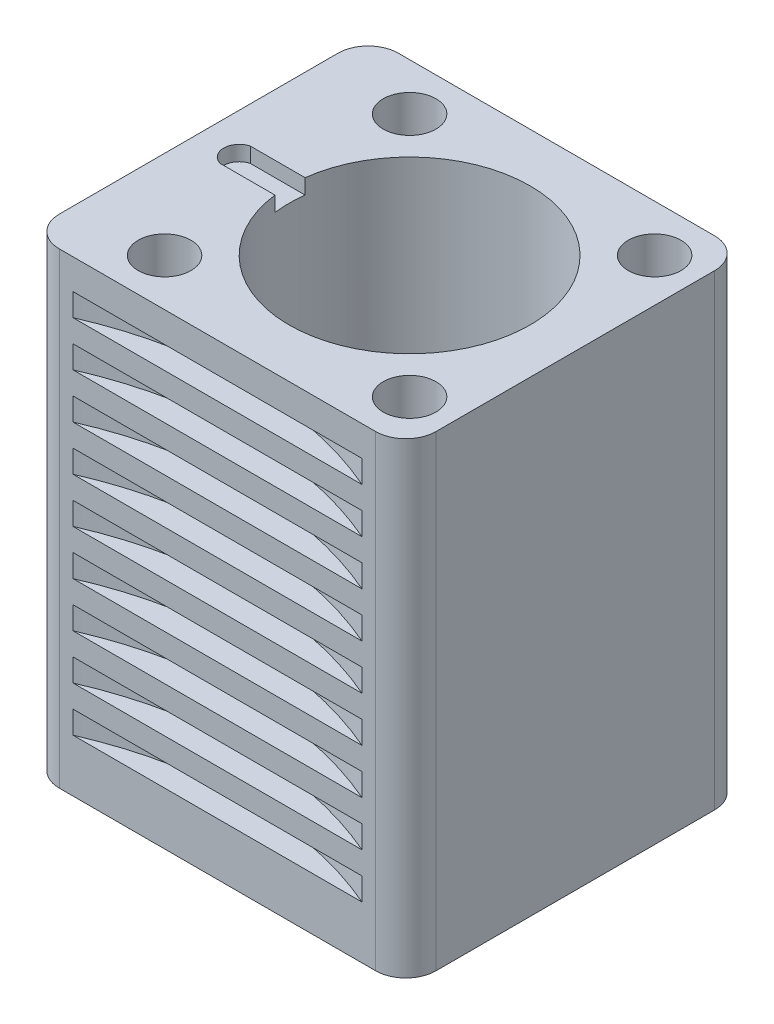
from build123d import *

# Parameters (mm, degrees)
BOSS_EXTRUDE1_DEPTH     = 62
SKETCH2_R               = 18
BOSS_EXTRUDE2_DEPTH     = 2
SKETCH3_R               = 16
CUT_EXTRUDE1_DEPTH      = 74.391075752
CUT_EXTRUDE2_DEPTH      = 2
SKETCH5_R               = 3.5
CUT_EXTRUDE3_DEPTH      = 74.391075752
SKETCH6_W               = 48
SKETCH6_H               = 3
LPATTERN1_COUNT         = 9
LPATTERN1_PITCH         = 6
MIRROR1_COPY_1_SKETCH_W = 48
MIRROR1_COPY_1_SKETCH_H = 3
MIRROR1_COPY_2_SKETCH_W = 48
MIRROR1_COPY_2_SKETCH_H = 3
MIRROR1_COPY_3_SKETCH_W = 48
MIRROR1_COPY_3_SKETCH_H = 3
MIRROR1_COPY_4_SKETCH_W = 48
MIRROR1_COPY_4_SKETCH_H = 3
MIRROR1_COPY_5_SKETCH_W = 48
MIRROR1_COPY_5_SKETCH_H = 3
MIRROR1_COPY_6_SKETCH_W = 48
MIRROR1_COPY_6_SKETCH_H = 3
MIRROR1_COPY_7_SKETCH_W = 48
MIRROR1_COPY_7_SKETCH_H = 3
MIRROR1_COPY_8_SKETCH_W = 48
MIRROR1_COPY_8_SKETCH_H = 3
SKETCH10_W              = 48
SKETCH10_H              = 3
LPATTERN2_COUNT         = 9
LPATTERN2_PITCH         = 6


with BuildPart() as part:
    # Sketch1 → Boss-Extrude1 (new body)
    with BuildSketch(Plane(origin=(0, 0, 0), x_dir=(1, 0, 0), z_dir=(0, 1, 0))):
        with BuildLine():
            Line((-24, -22.5), (18, -22.5))
            ThreePointArc((18, -22.5), (20.828427125, -21.328427125), (22, -18.5))
            Line((22, -18.5), (22, 18.5))
            ThreePointArc((22, 18.5), (20.828427125, 21.328427125), (18, 22.5))
            Line((18, 22.5), (-24, 22.5))
            ThreePointArc((-24, 22.5), (-26.828427125, 21.328427125), (-28, 18.5))
            Line((-28, 18.5), (-28, -18.5))
            ThreePointArc((-28, -18.5), (-26.828427125, -21.328427125), (-24, -22.5))
        make_face()
    extrude(amount=BOSS_EXTRUDE1_DEPTH)

    # Sketch2 → Boss-Extrude2 (add)
    with BuildSketch(Plane.XZ):
        with Locations(Location((0, 0, 0), (0, 0, 270))):
            Circle(SKETCH2_R)
    extrude(amount=BOSS_EXTRUDE2_DEPTH)

    # Sketch3 → Cut-Extrude1 (cut, through all)
    with BuildSketch(Plane.XZ.offset(2)):
        with Locations(Location((0, 0, 0), (0, 0, 270))):
            Circle(SKETCH3_R)
    extrude(amount=-CUT_EXTRUDE1_DEPTH, mode=Mode.SUBTRACT)

    # Sketch4 → Cut-Extrude2 (cut)
    with BuildSketch(Plane(origin=(0, 62, 0), x_dir=(1, 0, 0), z_dir=(0, 1, 0))):
        with BuildLine():
            Line((-23.144533893, 2), (-8.5852446, 2))
            Line((-8.5852446, 2), (-8.5852446, -2))
            Line((-8.5852446, -2), (-23.144533893, -2))
            ThreePointArc((-23.144533893, -2), (-24.680199624, 0), (-23.144533893, 2))
        make_face()
    extrude(amount=-CUT_EXTRUDE2_DEPTH, mode=Mode.SUBTRACT)

    # Sketch5 → Cut-Extrude3 (cut, through all)
    with BuildSketch(Plane(origin=(0, 62, 0), x_dir=(1, 0, 0), z_dir=(0, 1, 0))):
        with Locations(Location((16.263455967, 16.263455967, 0), (0, 0, 270))):
            Circle(SKETCH5_R)
        with Locations(Location((16.263455967, -16.263455967, 0), (0, 0, 270))):
            Circle(SKETCH5_R)
        with Locations(Location((-16.263455967, -16.263455967, 0), (0, 0, 270))):
            Circle(SKETCH5_R)
        with Locations(Location((-16.263455967, 16.263455967, 0), (0, 0, 270))):
            Circle(SKETCH5_R)
    extrude(amount=-CUT_EXTRUDE3_DEPTH, mode=Mode.SUBTRACT)

    # Sketch6 → Cut-Revolve1 (revolve, cut)
    with BuildSketch(Plane(origin=(-3, 0, 0), x_dir=(0, 0, -1), z_dir=(1, 0, 0))):
        with Locations((-42.5, 56.5)):
            Rectangle(SKETCH6_W, SKETCH6_H)
    cut_revolve1 = revolve(axis=Axis((-3, 58, 66.5), (0, -1, 0)), mode=Mode.SUBTRACT)

    # LPattern1: Cut-Revolve1 ×9
    with Locations(*[(0, -i * LPATTERN1_PITCH, 0) for i in range(1, LPATTERN1_COUNT)]):
        add(cut_revolve1, mode=Mode.SUBTRACT)

    # Mirror1: Cut-Revolve1 across plane
    add(cut_revolve1.mirror(Plane.XY), mode=Mode.SUBTRACT)

    # Mirror1 copy 1 sketch → Mirror1 copy 1 (revolve, cut)
    with BuildSketch(Plane(origin=(-3, -6, 0), x_dir=(0, 0, 1), z_dir=(1, 0, 0))):
        with Locations((-42.5, -56.5)):
            Rectangle(MIRROR1_COPY_1_SKETCH_W, MIRROR1_COPY_1_SKETCH_H)
    revolve(axis=Axis((-3, 52, -66.5), (0, 1, 0)), mode=Mode.SUBTRACT)

    # Mirror1 copy 2 sketch → Mirror1 copy 2 (revolve, cut)
    with BuildSketch(Plane(origin=(-3, -12, 0), x_dir=(0, 0, 1), z_dir=(1, 0, 0))):
        with Locations((-42.5, -56.5)):
            Rectangle(MIRROR1_COPY_2_SKETCH_W, MIRROR1_COPY_2_SKETCH_H)
    revolve(axis=Axis((-3, 46, -66.5), (0, 1, 0)), mode=Mode.SUBTRACT)

    # Mirror1 copy 3 sketch → Mirror1 copy 3 (revolve, cut)
    with BuildSketch(Plane(origin=(-3, -18, 0), x_dir=(0, 0, 1), z_dir=(1, 0, 0))):
        with Locations((-42.5, -56.5)):
            Rectangle(MIRROR1_COPY_3_SKETCH_W, MIRROR1_COPY_3_SKETCH_H)
    revolve(axis=Axis((-3, 40, -66.5), (0, 1, 0)), mode=Mode.SUBTRACT)

    # Mirror1 copy 4 sketch → Mirror1 copy 4 (revolve, cut)
    with BuildSketch(Plane(origin=(-3, -24, 0), x_dir=(0, 0, 1), z_dir=(1, 0, 0))):
        with Locations((-42.5, -56.5)):
            Rectangle(MIRROR1_COPY_4_SKETCH_W, MIRROR1_COPY_4_SKETCH_H)
    revolve(axis=Axis((-3, 34, -66.5), (0, 1, 0)), mode=Mode.SUBTRACT)

    # Mirror1 copy 5 sketch → Mirror1 copy 5 (revolve, cut)
    with BuildSketch(Plane(origin=(-3, -30, 0), x_dir=(0, 0, 1), z_dir=(1, 0, 0))):
        with Locations((-42.5, -56.5)):
            Rectangle(MIRROR1_COPY_5_SKETCH_W, MIRROR1_COPY_5_SKETCH_H)
    revolve(axis=Axis((-3, 28, -66.5), (0, 1, 0)), mode=Mode.SUBTRACT)

    # Mirror1 copy 6 sketch → Mirror1 copy 6 (revolve, cut)
    with BuildSketch(Plane(origin=(-3, -36, 0), x_dir=(0, 0, 1), z_dir=(1, 0, 0))):
        with Locations((-42.5, -56.5)):
            Rectangle(MIRROR1_COPY_6_SKETCH_W, MIRROR1_COPY_6_SKETCH_H)
    revolve(axis=Axis((-3, 22, -66.5), (0, 1, 0)), mode=Mode.SUBTRACT)

    # Mirror1 copy 7 sketch → Mirror1 copy 7 (revolve, cut)
    with BuildSketch(Plane(origin=(-3, -42, 0), x_dir=(0, 0, 1), z_dir=(1, 0, 0))):
        with Locations((-42.5, -56.5)):
            Rectangle(MIRROR1_COPY_7_SKETCH_W, MIRROR1_COPY_7_SKETCH_H)
    revolve(axis=Axis((-3, 16, -66.5), (0, 1, 0)), mode=Mode.SUBTRACT)

    # Mirror1 copy 8 sketch → Mirror1 copy 8 (revolve, cut)
    with BuildSketch(Plane(origin=(-3, -48, 0), x_dir=(0, 0, 1), z_dir=(1, 0, 0))):
        with Locations((-42.5, -56.5)):
            Rectangle(MIRROR1_COPY_8_SKETCH_W, MIRROR1_COPY_8_SKETCH_H)
    revolve(axis=Axis((-3, 10, -66.5), (0, 1, 0)), mode=Mode.SUBTRACT)

    # Sketch10 → Cut-Revolve2 (revolve, cut)
    with BuildSketch(Plane.XY):
        with Locations((-48, 56.5)):
            Rectangle(SKETCH10_W, SKETCH10_H)
    cut_revolve2 = revolve(axis=Axis((-72, 58, 0), (0, -1, 0)), mode=Mode.SUBTRACT)

    # LPattern2: Cut-Revolve2 ×9
    with Locations(*[(0, -i * LPATTERN2_PITCH, 0) for i in range(1, LPATTERN2_COUNT)]):
        add(cut_revolve2, mode=Mode.SUBTRACT)


solid = part.part
